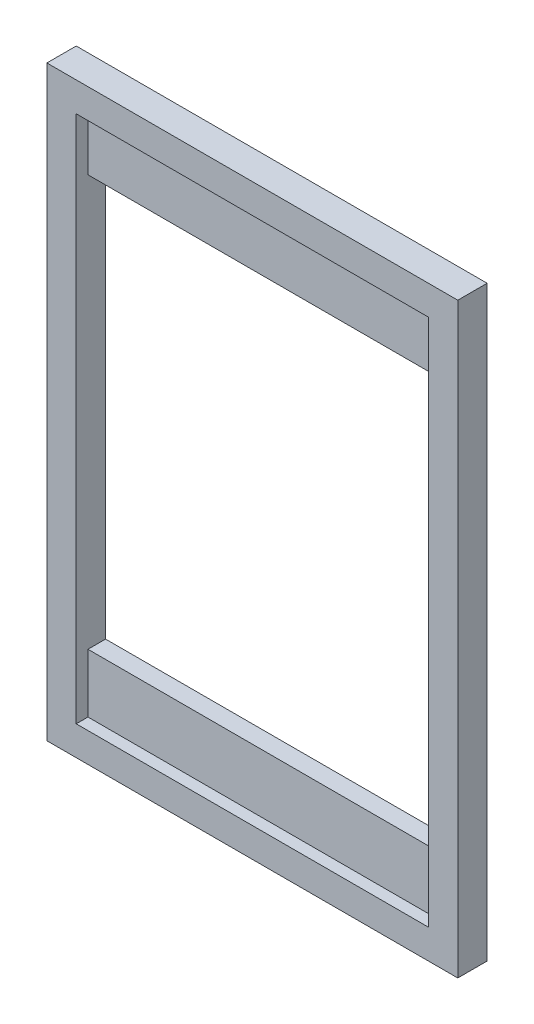
from build123d import *

# Parameters (mm, degrees)
SKETCH1_W           = 100
SKETCH1_H           = 70
BOSS_EXTRUDE1_DEPTH = 5
SKETCH2_W           = 60
SKETCH2_H           = 90
CUT_EXTRUDE1_DEPTH  = 62.23724357
SKETCH4_W           = 60
SKETCH4_H           = 3
BOSS_EXTRUDE2_DEPTH = 10
SKETCH5_W           = 60
SKETCH5_H           = 3
BOSS_EXTRUDE3_DEPTH = 10


with BuildPart() as part:
    # Sketch1 → Boss-Extrude1 (new body)
    with BuildSketch(Plane(origin=(0, 0, 0), x_dir=(0, 1, 0), z_dir=(0, 0, 1))):
        Rectangle(SKETCH1_W, SKETCH1_H)
    extrude(amount=BOSS_EXTRUDE1_DEPTH)

    # Sketch2 → Cut-Extrude1 (cut, through all)
    with BuildSketch(Plane.XY.offset(5)):
        Rectangle(SKETCH2_W, SKETCH2_H)
    extrude(amount=-CUT_EXTRUDE1_DEPTH, mode=Mode.SUBTRACT)

    # Sketch4 → Boss-Extrude2 (add)
    with BuildSketch(Plane.XZ.offset(-45)):
        with Locations((0, 1.5)):
            Rectangle(SKETCH4_W, SKETCH4_H)
    extrude(amount=BOSS_EXTRUDE2_DEPTH)

    # Sketch5 → Boss-Extrude3 (add)
    with BuildSketch(Plane(origin=(-45, -45, 0), x_dir=(1, 0, 0), z_dir=(0, 1, 0))):
        with Locations((45, -1.5)):
            Rectangle(SKETCH5_W, SKETCH5_H)
    extrude(amount=BOSS_EXTRUDE3_DEPTH)


solid = part.part
